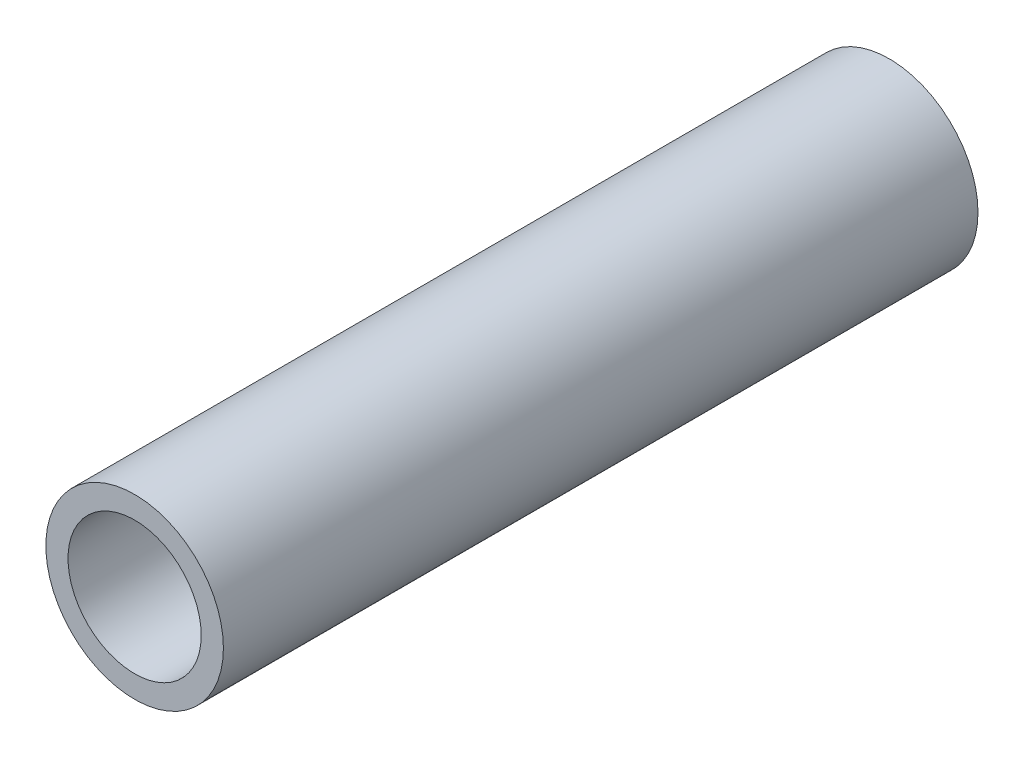
from build123d import *

# Parameters (mm, degrees)
SKETCH_1_R      = 2
SKETCH_1_R_2    = 1.5
EXTRUDE_1_DEPTH = 17


with BuildPart() as part:
    # 草图1 → 凸台-拉伸1 (new body)
    with BuildSketch(Plane.XY):
        Circle(SKETCH_1_R)
        Circle(SKETCH_1_R_2, mode=Mode.SUBTRACT)
    extrude(amount=EXTRUDE_1_DEPTH)


solid = part.part
